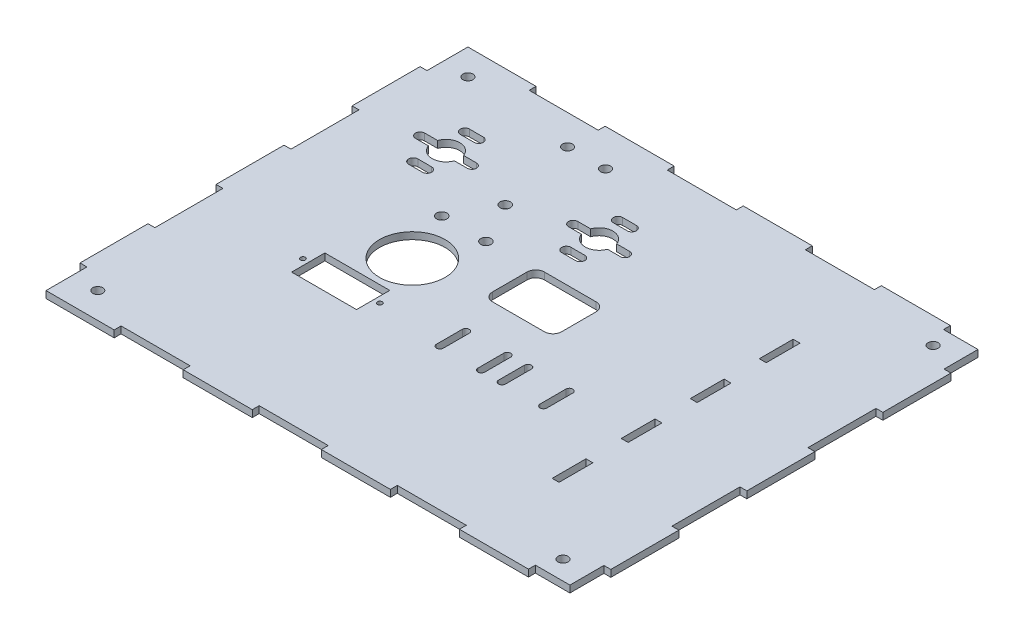
from build123d import *

# Parameters (mm, degrees)
SKETCH1_W                 = 88.9
SKETCH1_H                 = 84.12226
BOSS_EXTRUDE1_DEPTH       = 2.54
SKETCH2_R                 = 5.08
CUT_EXTRUDE1_DEPTH        = 2.54
SKETCH3_R                 = 12.065
CUT_EXTRUDE2_DEPTH        = 74.692319271
SKETCH4_R                 = 0.889
SKETCH4_W                 = 23.876
SKETCH4_H                 = 11.7094
CUT_EXTRUDE3_DEPTH        = 74.692319271
F_6_CLEARANCE_HOLE1_D     = 3.7973
BOSS_EXTRUDE2_DEPTH       = 2.54
SKETCH10_W                = 2.54
SKETCH10_H                = 12.446
CUT_EXTRUDE4_DEPTH        = 172.20227832
LPATTERN1_COUNT           = 4
LPATTERN1_PITCH           = 25.4
SKETCH11_W                = 25.4
SKETCH11_H                = 2.54
BOSS_EXTRUDE3_DEPTH       = 2.54
LPATTERN2_COUNT           = 4
LPATTERN2_PITCH           = 50.8
LPATTERN2_COUNT_DIR2      = 2
LPATTERN2_PITCH_DIR2      = 152.654
SKETCH12_W                = 2.54
SKETCH12_H                = 25.019
BOSS_EXTRUDE4_DEPTH       = 2.54
LPATTERN3_COUNT           = 3
LPATTERN3_PITCH           = 50.038
SKETCH13_W                = 13.02766
SKETCH13_H                = 155.194
CUT_EXTRUDE5_DEPTH        = 175.774762566
F_6_CLEARANCE_HOLE2_D     = 3.6576
SKETCH17_W                = 12.7
SKETCH17_H                = 155.194
BOSS_EXTRUDE5_DEPTH       = 2.54
LPATTERN4_COUNT           = 2
LPATTERN4_PITCH           = 192.71234
LPATTERN4_COPY_1_SKETCH_W = 2.54
LPATTERN4_COPY_1_SKETCH_H = 25.019
LPATTERN4_COPY_1_DEPTH    = 2.54
LPATTERN4_COPY_2_SKETCH_W = 2.54
LPATTERN4_COPY_2_SKETCH_H = 25.019
LPATTERN4_COPY_2_DEPTH    = 2.54
SKETCH18_W                = 25.4
SKETCH18_H                = 19.05
CUT_EXTRUDE6_DEPTH        = 175.774762566
FILLET1_R                 = 3.175
CUT_EXTRUDE7_DEPTH        = 2.54
LPATTERN5_COUNT           = 6
LPATTERN5_PITCH           = 7.62
F_6_CLEARANCE_HOLE3_D     = 3.6576
F_6_CLEARANCE_HOLE3_DEPTH = 9.398
F_6_CLEARANCE_HOLE3_TIP   = 1.0988539


with BuildPart() as part:
    # Sketch1 → Boss-Extrude1 (new body)
    with BuildSketch(Plane(origin=(0, 0, 0), x_dir=(1, 0, 0), z_dir=(0, 1, 0))):
        with Locations((0, -16.66113)):
            Rectangle(SKETCH1_W, SKETCH1_H)
    extrude(amount=BOSS_EXTRUDE1_DEPTH)

    # Sketch2 → Cut-Extrude1 (cut)
    with BuildSketch(Plane(origin=(0, 2.54, 0), x_dir=(1, 0, 0), z_dir=(0, 1, 0))):
        with Locations((-28.1548967, 7.85)):
            Circle(SKETCH2_R)
        with BuildLine():
            Line((-25.6148967, 15.65), (-30.6948967, 15.65))
            ThreePointArc((-30.6948967, 15.65), (-32.3948967, 17.35), (-30.6948967, 19.05))
            Line((-30.6948967, 19.05), (-25.6148967, 19.05))
            ThreePointArc((-25.6148967, 19.05), (-23.9148967, 17.35), (-25.6148967, 15.65))
        make_face()
        with BuildLine():
            Line((-30.6948967, 0.05), (-25.6148967, 0.05))
            ThreePointArc((-25.6148967, 0.05), (-23.9148967, -1.65), (-25.6148967, -3.35))
            Line((-25.6148967, -3.35), (-30.6948967, -3.35))
            ThreePointArc((-30.6948967, -3.35), (-32.3948967, -1.65), (-30.6948967, 0.05))
        make_face()
        with BuildLine():
            Line((-37.6798967, 9.55), (-18.6298967, 9.55))
            ThreePointArc((-18.6298967, 9.55), (-16.9298967, 7.85), (-18.6298967, 6.15))
            Line((-18.6298967, 6.15), (-37.6798967, 6.15))
            ThreePointArc((-37.6798967, 6.15), (-39.3798967, 7.85), (-37.6798967, 9.55))
        make_face()
    cut_extrude1 = extrude(amount=-CUT_EXTRUDE1_DEPTH, mode=Mode.SUBTRACT)

    # Mirror1: Cut-Extrude1 across plane
    add(cut_extrude1.mirror(Plane(origin=(0, 0, 0), x_dir=(0, 0, 1), z_dir=(1, 0, 0))), mode=Mode.SUBTRACT)

    # Sketch3 → Cut-Extrude2 (cut, through all)
    with BuildSketch(Plane(origin=(0, 2.54, 0), x_dir=(1, 0, 0), z_dir=(0, 1, 0))):
        with Locations(Location((0, -32.6884, 0), (0, 0, 270))):
            Circle(SKETCH3_R)
    extrude(amount=-CUT_EXTRUDE2_DEPTH, mode=Mode.SUBTRACT)

    # Sketch4 → Cut-Extrude3 (cut, through all)
    with BuildSketch(Plane(origin=(0, 2.54, 0), x_dir=(1, 0, 0), z_dir=(0, 1, 0))):
        with Locations(Location((-20.0787, -52.86756, 0), (0, 0, 270))):
            Circle(SKETCH4_R)
        with Locations(Location((8.2423, -52.86756, 0), (0, 0, 270))):
            Circle(SKETCH4_R)
        with Locations((-5.9182, -52.86756)):
            Rectangle(SKETCH4_W, SKETCH4_H)
    extrude(amount=-CUT_EXTRUDE3_DEPTH, mode=Mode.SUBTRACT)

    # #6 Clearance Hole1 (through all)
    with Locations(Plane(origin=(0, 2.54, 0), x_dir=(1, 0, 0), z_dir=(0, 1, 0))):
        with Locations((0, 1.4986), (-8.128, -13.7414), (8.128, -13.7414)):
            Hole(F_6_CLEARANCE_HOLE1_D / 2)

    # Sketch9 → Boss-Extrude2 (add)
    with BuildSketch(Plane(origin=(0, 0, 0), x_dir=(1, 0, 0), z_dir=(0, 1, 0))):
        Polygon((-44.45, 25.4), (44.45, 25.4), (44.45, -58.72226), (6.0198, -58.72226), (6.0198, -59.23026), (-17.8562, -59.23026), (-17.8562, -58.72226), (-44.45, -58.72226), (-44.45, -107.74426), (133.02234, -107.74426), (133.02234, 42.36974), (-44.45, 42.36974), align=None)
    extrude(amount=BOSS_EXTRUDE2_DEPTH)

    # Sketch10 → Cut-Extrude4 (cut, through all)
    with BuildSketch(Plane(origin=(0, 2.54, 0), x_dir=(1, 0, 0), z_dir=(0, 1, 0))):
        with Locations((97.03054, 5.41274)):
            Rectangle(SKETCH10_W, SKETCH10_H)
    cut_extrude4 = extrude(amount=-CUT_EXTRUDE4_DEPTH, mode=Mode.SUBTRACT)

    # LPattern1: Cut-Extrude4 ×4
    with Locations(*[(0, 0, i * LPATTERN1_PITCH) for i in range(1, LPATTERN1_COUNT)]):
        add(cut_extrude4, mode=Mode.SUBTRACT)

    # Sketch11 → Boss-Extrude3 (add)
    with BuildSketch(Plane(origin=(0, 2.54, 0), x_dir=(1, 0, 0), z_dir=(0, 1, 0))):
        with Locations((107.62234, -109.01426)):
            Rectangle(SKETCH11_W, SKETCH11_H)
    boss_extrude3 = extrude(amount=-BOSS_EXTRUDE3_DEPTH)

    # LPattern2: Boss-Extrude3 4 × 2
    with Locations(*[(-i * LPATTERN2_PITCH, 0, -j * LPATTERN2_PITCH_DIR2) for i in range(LPATTERN2_COUNT) for j in range(LPATTERN2_COUNT_DIR2) if (i, j) != (0, 0)]):
        add(boss_extrude3)

    # Sketch12 → Boss-Extrude4 (add)
    with BuildSketch(Plane(origin=(0, 2.54, 0), x_dir=(1, 0, 0), z_dir=(0, 1, 0))):
        with Locations((134.29234, -82.72526)):
            Rectangle(SKETCH12_W, SKETCH12_H)
    boss_extrude4 = extrude(amount=-BOSS_EXTRUDE4_DEPTH)

    # LPattern3: Boss-Extrude4 ×3
    with Locations(*[(0, 0, -i * LPATTERN3_PITCH) for i in range(1, LPATTERN3_COUNT)]):
        add(boss_extrude4)

    # Sketch13 → Cut-Extrude5 (cut, through all)
    with BuildSketch(Plane(origin=(0, 2.54, 0), x_dir=(1, 0, 0), z_dir=(0, 1, 0))):
        with Locations((-50.96383, -32.68726)):
            Rectangle(SKETCH13_W, SKETCH13_H)
    extrude(amount=-CUT_EXTRUDE5_DEPTH, mode=Mode.SUBTRACT)

    # #6 Clearance Hole2 (through all)
    with Locations(Plane(origin=(0, 0, 0), x_dir=(-1, 0, 0), z_dir=(0, -1, 0))):
        with Locations((6.990100066, 31.390026268), (-6.979899934, 31.390026268)):
            Hole(F_6_CLEARANCE_HOLE2_D / 2)

    # Sketch17 → Boss-Extrude5 (add)
    with BuildSketch(Plane(origin=(0, 2.54, 0), x_dir=(1, 0, 0), z_dir=(0, 1, 0))):
        with Locations((-50.8, -32.68726)):
            Rectangle(SKETCH17_W, SKETCH17_H)
    extrude(amount=-BOSS_EXTRUDE5_DEPTH)

    # LPattern4: Boss-Extrude4 ×2
    with Locations(*[(-i * LPATTERN4_PITCH, 0, 0) for i in range(1, LPATTERN4_COUNT)]):
        add(boss_extrude4)

    # LPattern4 copy 1 sketch → LPattern4 copy 1 (add)
    with BuildSketch(Plane(origin=(-192.71234, 2.54, -50.038), x_dir=(1, 0, 0), z_dir=(0, 1, 0))):
        with Locations((134.29234, -82.72526)):
            Rectangle(LPATTERN4_COPY_1_SKETCH_W, LPATTERN4_COPY_1_SKETCH_H)
    extrude(amount=-LPATTERN4_COPY_1_DEPTH)

    # LPattern4 copy 2 sketch → LPattern4 copy 2 (add)
    with BuildSketch(Plane(origin=(-192.71234, 2.54, -100.076), x_dir=(1, 0, 0), z_dir=(0, 1, 0))):
        with Locations((134.29234, -82.72526)):
            Rectangle(LPATTERN4_COPY_2_SKETCH_W, LPATTERN4_COPY_2_SKETCH_H)
    extrude(amount=-LPATTERN4_COPY_2_DEPTH)

    # Sketch18 → Cut-Extrude6 (cut, through all)
    with BuildSketch(Plane(origin=(0, 2.54, 0), x_dir=(1, 0, 0), z_dir=(0, 1, 0))):
        with Locations((38.1, -22.225)):
            Rectangle(SKETCH18_W, SKETCH18_H)
    extrude(amount=-CUT_EXTRUDE6_DEPTH, mode=Mode.SUBTRACT)

    # Fillet1
    fillet1_edges = [part.edges().sort_by_distance(p)[0] for p in [
        (25.4, 1.27, 31.75),
        (25.4, 1.27, 12.7),
        (50.8, 1.27, 12.7),
        (50.8, 1.27, 31.75),
    ]]
    fillet(fillet1_edges, radius=FILLET1_R)

    # Sketch19 → Cut-Extrude7 (cut)
    with BuildSketch(Plane(origin=(0, 2.54, 0), x_dir=(1, 0, 0), z_dir=(0, 1, 0))):
        with BuildLine():
            Line((34.29, -46.0375), (34.29, -55.5625))
            ThreePointArc((34.29, -55.5625), (33.02, -56.8325), (31.75, -55.5625))
            Line((31.75, -55.5625), (31.75, -46.0375))
            ThreePointArc((31.75, -46.0375), (33.02, -44.7675), (34.29, -46.0375))
        make_face()
    cut_extrude7 = extrude(amount=-CUT_EXTRUDE7_DEPTH, mode=Mode.SUBTRACT)

    # LPattern5: Cut-Extrude7 ×6, 2 skipped
    with Locations(*[(i * LPATTERN5_PITCH, 0, 0) for i in range(1, LPATTERN5_COUNT) if i not in (1, 4)]):
        add(cut_extrude7, mode=Mode.SUBTRACT)

    # #6 Clearance Hole3
    with Locations(Plane(origin=(0, 2.54, 0), x_dir=(1, 0, 0), z_dir=(0, 1, 0))):
        with Locations((-47.625, 35.38474), (-47.625, -100.75926), (123.49734, -100.75926), (123.49734, 35.38474)):
            Hole(F_6_CLEARANCE_HOLE3_D / 2, depth=F_6_CLEARANCE_HOLE3_DEPTH)
            with Locations((0, 0, -(F_6_CLEARANCE_HOLE3_DEPTH + F_6_CLEARANCE_HOLE3_TIP / 2))):  # 118° drill point
                Cone(0, F_6_CLEARANCE_HOLE3_D / 2, F_6_CLEARANCE_HOLE3_TIP, mode=Mode.SUBTRACT)


solid = part.part
